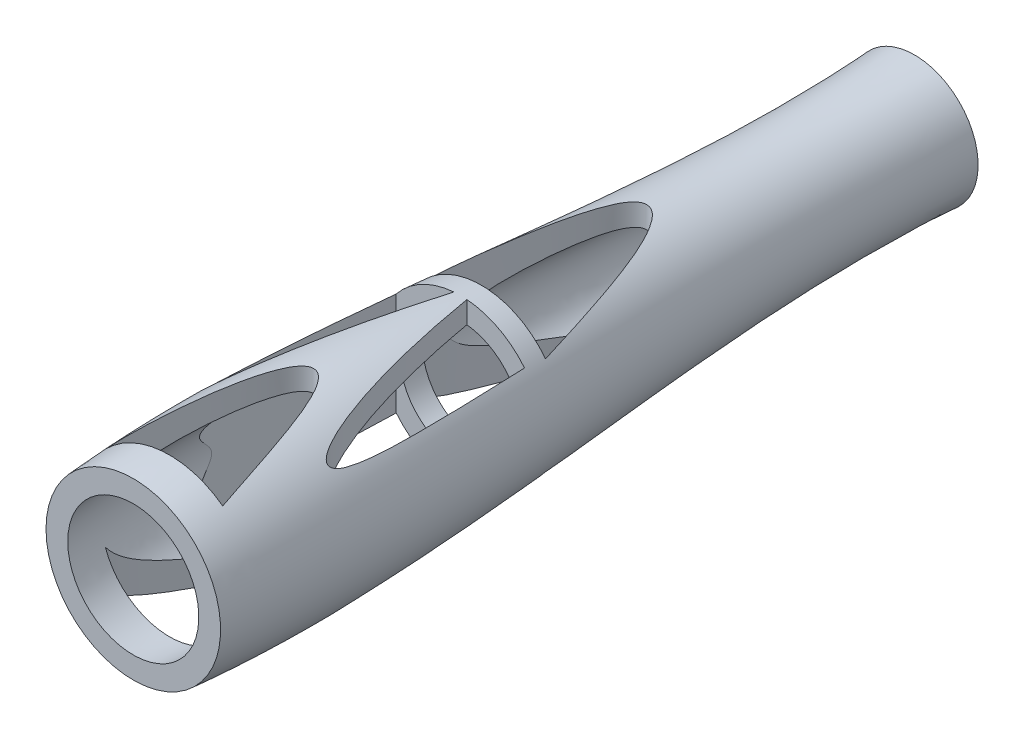
from build123d import *

# Parameters (mm, degrees)
SHELL1_T                = -0.005
CUT_EXTRUDE1_DEPTH      = 10
CUT_EXTRUDE1_DEPTH_BACK = 0.05


with BuildPart() as part:
    # Sketch1 → Revolve1 (revolve)
    with BuildSketch(Plane(origin=(0, 0, 0), x_dir=(1, 0, 0), z_dir=(0, 1, 0))):
        with BuildLine():
            Line((0, 0), (0.020112576, 0))
            add(Edge.make_bspline(
                [(0.020112576, 0), (0.0248075, 0.060287097), (0.011112713, 0.119756643), (0.014649309, 0.180000007)],
                knots=[0, 0, 0, 0, 1, 1, 1, 1], degree=3))
            Line((0.014649309, 0.180000007), (0, 0.180000007))
            Line((0, 0.180000007), (0, 0))
        make_face()
    revolve(axis=Axis((0, 0, -0.217728347), (0, 0, 1)))

    # Shell1
    shell1_openings = [part.faces().sort_by_distance(p)[0] for p in [
        (0, 0, 0),
    ]]
    offset(amount=SHELL1_T, openings=shell1_openings, kind=Kind.INTERSECTION)

    # Sketch2 → Cut-Extrude1 (cut, two sides: drawn at the far end of the back side and taken through both)
    with BuildSketch(Plane(origin=(0, 0, 0), x_dir=(1, 0, 0), z_dir=(0, 1, 0)).offset(-CUT_EXTRUDE1_DEPTH_BACK)):
        with BuildLine():
            Line((-0.014778847, 0.008340619), (0.012273958, 0.008340619))
            add(Edge.make_bspline(
                [(-0.014778847, 0.008340619), (-0.009380156, 0.019643139), (-0.001485445, 0.078095479), (0.012273958, 0.008340619)],
                knots=[0, 0, 0, 0, 1, 1, 1, 1], degree=3))
        make_face()
        with BuildLine():
            Line((-0.014778847, 0.075361803), (-0.001502934, 0.075361803))
            add(Edge.make_bspline(
                [(-0.001502934, 0.075361803), (-0.021148275, -0.015167476), (-0.014778847, 0.075361803)],
                knots=[0, 0, 0, 1, 1, 1], degree=2))
        make_face()
        with BuildLine():
            Line((0.014778847, 0.075361803), (0.001502934, 0.075361803))
            add(Edge.make_bspline(
                [(0.001502934, 0.075361803), (0.021148275, -0.015167476), (0.014778847, 0.075361803)],
                knots=[0, 0, 0, 1, 1, 1], degree=2))
        make_face()
        with BuildLine():
            Line((-0.014778847, 0.080200877), (0.014778847, 0.080200877))
            add(Edge.make_bspline(
                [(-0.014778847, 0.080200877), (-0.009826415, 0.093091992), (-0.001459835, 0.158992867), (0.014778847, 0.080200877)],
                knots=[0, 0, 0, 0, 1, 1, 1, 1], degree=3))
        make_face()
    extrude(amount=CUT_EXTRUDE1_DEPTH + CUT_EXTRUDE1_DEPTH_BACK, mode=Mode.SUBTRACT)


solid = part.part
